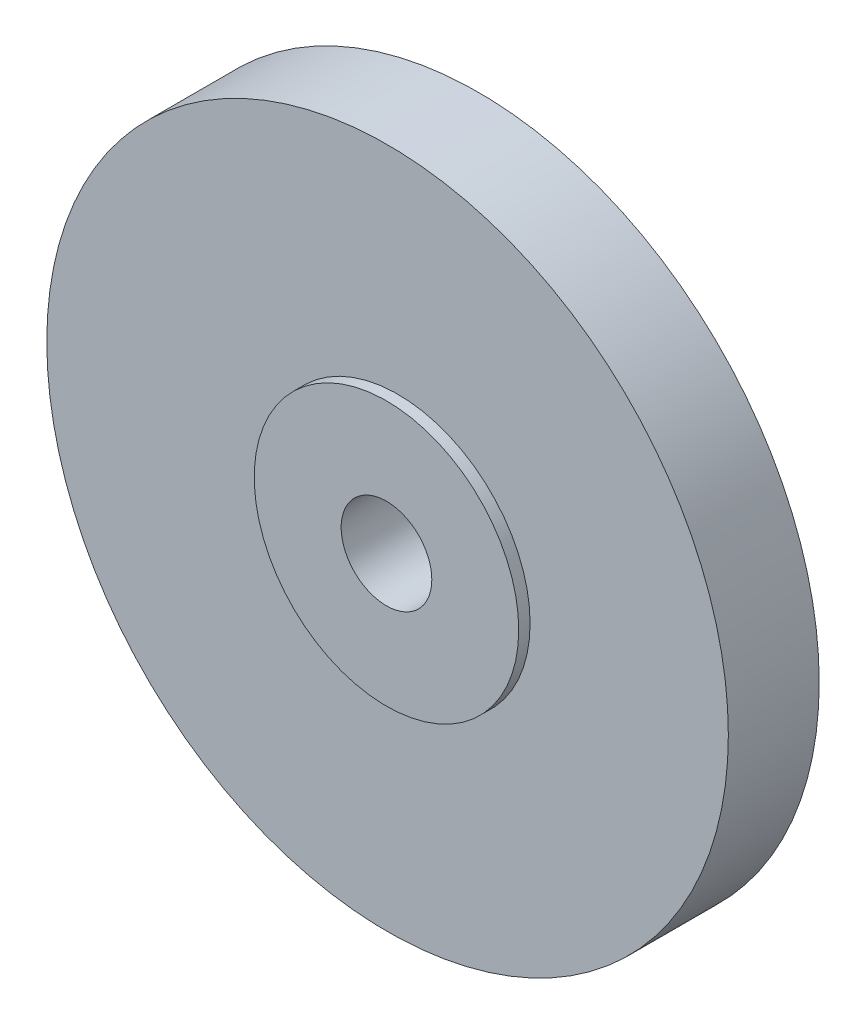
from build123d import *

# Parameters (mm, degrees)
CROQUIS1_R              = 300
SALIENTE_EXTRUIR1_DEPTH = 80
CROQUIS2_R              = 116.427160802
SALIENTE_EXTRUIR2_DEPTH = 10
CROQUIS3_R              = 39.900343406
CORTAR_EXTRUIR1_DEPTH   = 90


with BuildPart() as part:
    # Croquis1 → Saliente-Extruir1 (new body)
    with BuildSketch(Plane.XY):
        with Locations((-9.050170661, 2.119529712)):
            Circle(CROQUIS1_R)
    extrude(amount=SALIENTE_EXTRUIR1_DEPTH)

    # Croquis2 → Saliente-Extruir2 (add)
    with BuildSketch(Plane.XY.offset(80)):
        Circle(CROQUIS2_R)
    extrude(amount=SALIENTE_EXTRUIR2_DEPTH)

    # Croquis3 → Cortar-Extruir1 (cut)
    with BuildSketch(Plane.XY.offset(90)):
        Circle(CROQUIS3_R)
    extrude(amount=-CORTAR_EXTRUIR1_DEPTH, mode=Mode.SUBTRACT)


solid = part.part
